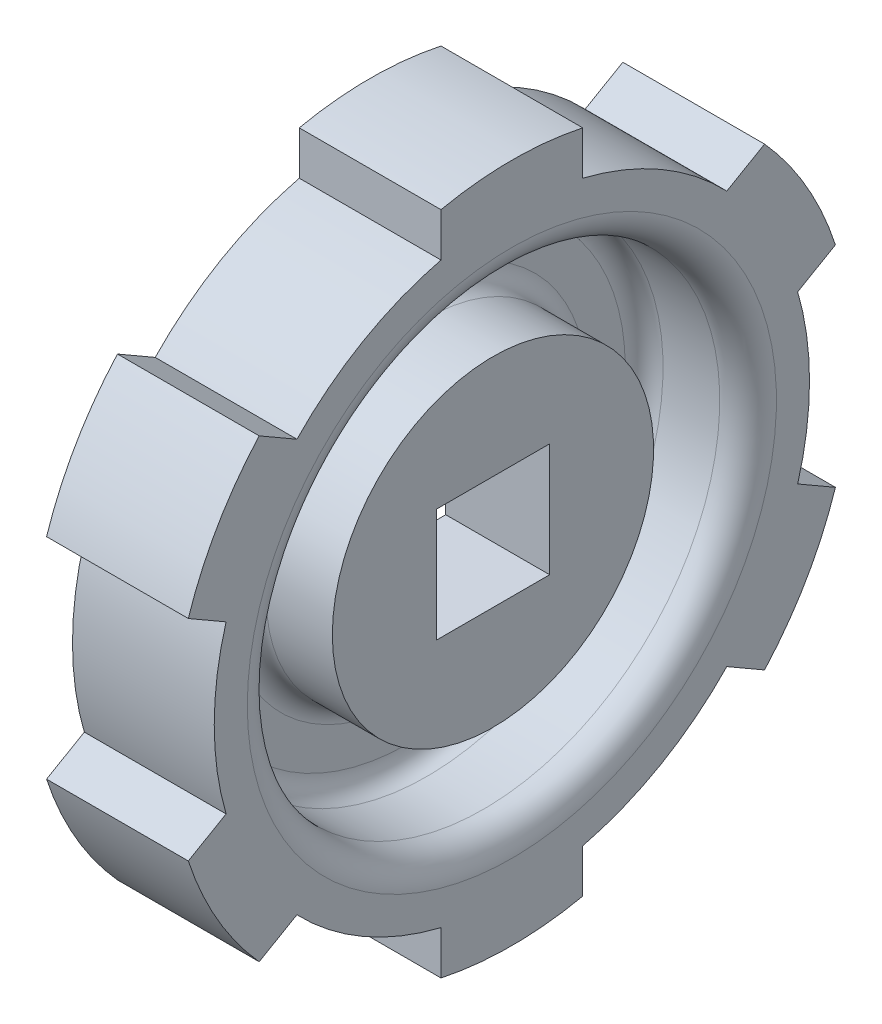
from build123d import *

# Parameters (mm, degrees)
SKETCH_2_W               = 12
SKETCH_2_H               = 12
CUT_EXTRUDE_1_DEPTH      = 47.405818601
EXTRUDE_START            = -15
EXTRUDE_1_DEPTH          = 15
PATTERN_CIRCULAR_1_COUNT = 6
FILLET_1_R               = 2


with BuildPart() as part:
    # Эскиз1 → Повернуть1 (revolve)
    with BuildSketch(Plane.XY, mode=Mode.PRIVATE) as revolve_1_sk:
        with BuildLine():
            Line((2, 0), (2, 15))
            Line((2, 15), (0, 15))
            Line((0, 15), (0, 31.5))
            Line((0, 31.5), (15, 31.5))
            Line((15, 31.5), (15, 28))
            ThreePointArc((15, 28), (14.121320344, 25.878679656), (12, 25))
            Line((12, 25), (4, 25))
            Line((4, 25), (4, 17))
            Line((4, 17), (13, 17))
            Line((13, 17), (13, 0))
            Line((13, 0), (2, 0))
        make_face()
    revolve(revolve_1_sk.sketch.rotate(Axis((0, 0, 0), (1, 0, 0)), 90), axis=Axis((0, 0, 0), (1, 0, 0)))

    # Эскиз2 → Вырез-Вытянуть1 (cut, through all)
    with BuildSketch(Plane.ZY.offset(-2)):
        Rectangle(SKETCH_2_W, SKETCH_2_H)
    extrude(amount=-CUT_EXTRUDE_1_DEPTH, mode=Mode.SUBTRACT)

    # Эскиз3 → Бобышка-Вытянуть1 (add)
    with BuildSketch(Plane.ZY.offset(EXTRUDE_START)):
        with BuildLine():
            ThreePointArc((7.5, 35.210083783), (0, 36), (-7.5, 35.210083783))
            Line((-7.5, 35.210083783), (-7.5, 30.594117082))
            ThreePointArc((-7.5, 30.594117082), (0, 31.5), (7.5, 30.594117082))
            Line((7.5, 30.594117082), (7.5, 35.210083783))
        make_face()
    extrude_1 = extrude(amount=EXTRUDE_1_DEPTH)

    # Круговой массив1: Бобышка-Вытянуть1 ×6 about axis
    pattern_circular_1_axis = Axis((0, 0, 0), (1, 0, 0))
    for i in range(1, PATTERN_CIRCULAR_1_COUNT):
        add(extrude_1.rotate(pattern_circular_1_axis, i * 360 / PATTERN_CIRCULAR_1_COUNT))

    # Скругление1
    fillet_1_edges = [part.edges().sort_by_distance(p)[0] for p in [
        (4, 0, -17),
        (4, 0, -25),
    ]]
    fillet(fillet_1_edges, radius=FILLET_1_R)


solid = part.part
